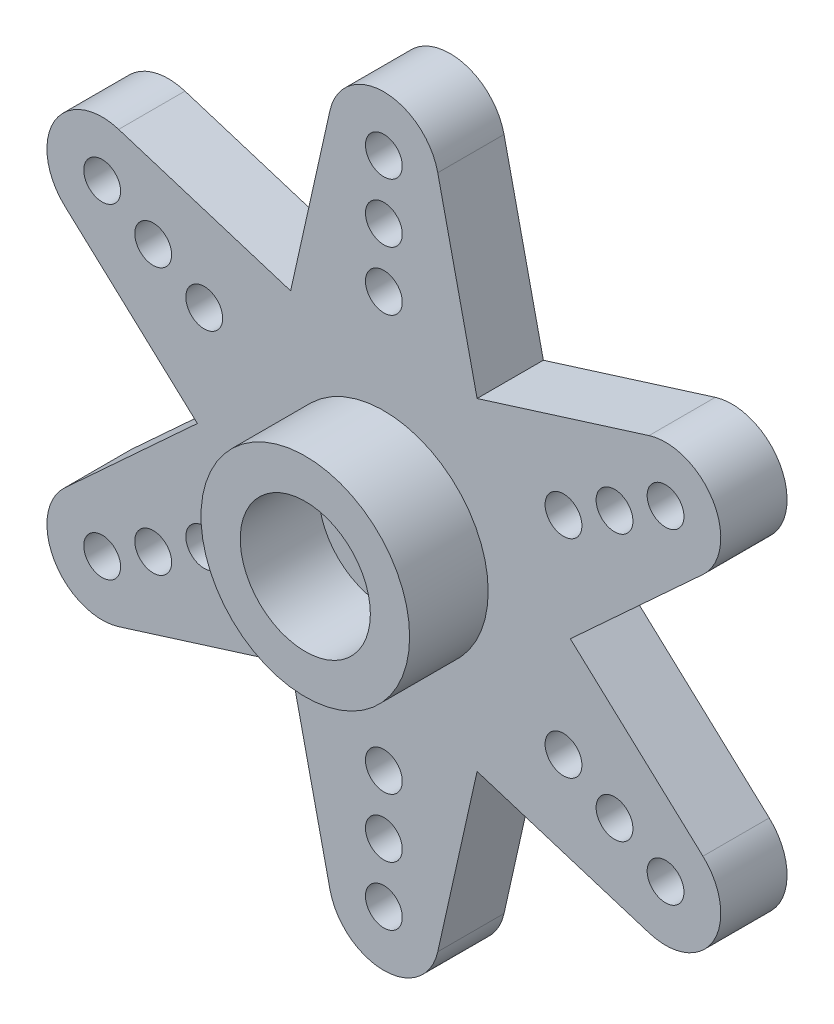
from build123d import *

# Parameters (mm, degrees)
ESBO_O1_R                = 0.75
ESBO_O1_R_2              = 1.5
RESSALTO_EXTRUS_O1_DEPTH = 2.7
PADR_OCIRCULAR1_COUNT    = 6
ESBO_O2_R                = 4.25
ESBO_O2_R_2              = 2.65
RESSALTO_EXTRUS_O2_DEPTH = 3.2
ESBO_O3_R                = 3.35
ESBO_O3_R_2              = 2.85
RESSALTO_EXTRUS_O3_DEPTH = 0.5


with BuildPart() as part:
    # Esboço1 → Ressalto-extrusão1 (new body)
    with BuildSketch(Plane.XY):
        with BuildLine():
            Line((-2.19575939, 13.74106079), (-4.15, 5.002749244))
            ThreePointArc((-4.15, 5.002749244), (0, -6.5), (4.15, 5.002749244))
            Line((4.15, 5.002749244), (2.19575939, 13.74106079))
            ThreePointArc((2.19575939, 13.74106079), (0, 15.5), (-2.19575939, 13.74106079))
        make_face()
        with Locations(Location((0, 13.25, 0), (0, 0, 180))):
            Circle(ESBO_O1_R, mode=Mode.SUBTRACT)
        with Locations(Location((0, 10.85, 0), (0, 0, 180))):
            Circle(ESBO_O1_R, mode=Mode.SUBTRACT)
        with Locations(Location((0, 8.45, 0), (0, 0, 180))):
            Circle(ESBO_O1_R, mode=Mode.SUBTRACT)
        with Locations(Location((0, 0, 0), (0, 0, 180))):
            Circle(ESBO_O1_R_2, mode=Mode.SUBTRACT)
    ressalto_extrus_o1 = extrude(amount=RESSALTO_EXTRUS_O1_DEPTH)

    # PadrãoCircular1: Ressalto-extrusão1 ×6 about axis
    padr_ocircular1_axis = Axis((0, 0, 0), (0, 0, 1))
    for i in range(1, PADR_OCIRCULAR1_COUNT):
        add(ressalto_extrus_o1.rotate(padr_ocircular1_axis, i * 360 / PADR_OCIRCULAR1_COUNT))

    # Esboço2 → Ressalto-extrusão2 (add)
    with BuildSketch(Plane.XY.offset(2.7)):
        Circle(ESBO_O2_R)
        Circle(ESBO_O2_R_2, mode=Mode.SUBTRACT)
    extrude(amount=RESSALTO_EXTRUS_O2_DEPTH)

    # Esboço3 → Ressalto-extrusão3 (add)
    with BuildSketch(Plane(origin=(0, 0, 0), x_dir=(-1, 0, 0), z_dir=(0, 0, -1))):
        with Locations(Location((0, 0, 0), (0, 0, 180))):
            Circle(ESBO_O3_R)
        Circle(ESBO_O3_R_2, mode=Mode.SUBTRACT)
    extrude(amount=RESSALTO_EXTRUS_O3_DEPTH)


solid = part.part
